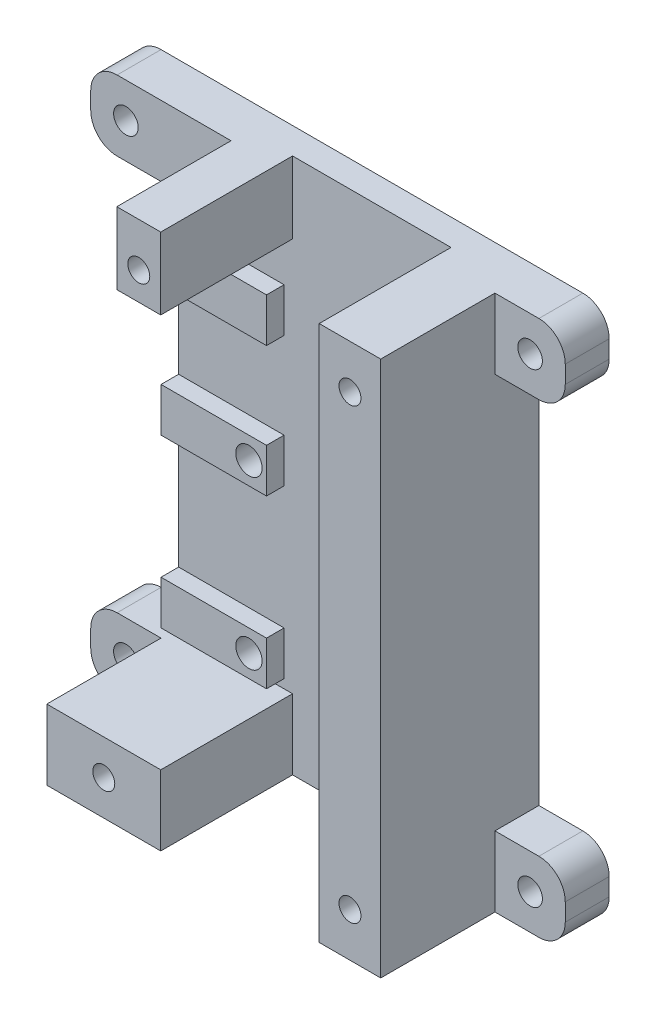
from build123d import *

# Parameters (mm, degrees)
ESQUISSE1_W             = 35
ESQUISSE1_H             = 40
BOSS_EXTRU_1_DEPTH      = 3
ESQUISSE2_R             = 2.013179567
ESQUISSE2_R_2           = 1.5
ENL_V_MAT_EXTRU_1_DEPTH = 10
ESQUISSE3_W             = 35
ESQUISSE3_H             = 3
BOSS_EXTRU_2_DEPTH      = 5
ESQUISSE4_W             = 4
ESQUISSE4_H             = 45
ESQUISSE4_W_2           = 12.966129595
ESQUISSE4_H_2           = 5
BOSS_EXTRU_3_DEPTH      = 15
BOSS_EXTRU_4_DEPTH      = 10
ESQUISSE6_W             = 5
ESQUISSE6_H             = 5.175
BOSS_EXTRU_5_DEPTH      = 15
ESQUISSE7_W             = 18
ESQUISSE7_H             = 55
BOSS_EXTRU_6_DEPTH      = 3
BOSS_EXTRU_7_DEPTH      = 3
BOSS_EXTRU_8_DEPTH      = 3
ESQUISSE10_R            = 1.25
ENL_V_MAT_EXTRU_2_DEPTH = 6
ESQUISSE11_W            = 5
ESQUISSE11_H            = 8
BOSS_EXTRU_9_DEPTH      = 8
ESQUISSE12_R            = 1.4
ENL_V_MAT_EXTRU_3_DEPTH = 8
ESQUISSE13_W            = 7.966129595
ESQUISSE13_H            = 8.175
BOSS_EXTRU_10_DEPTH     = 2
BOSS_EXTRU_12_START     = 2
ESQUISSE14_W            = 12
ESQUISSE14_H            = 5
ESQUISSE14_R            = 1.5
BOSS_EXTRU_12_DEPTH     = 2
CONG_1_R                = 3
ENL_V_START             = -2
ESQUISSE15_R            = 3.5
ESQUISSE15_R_2          = 1.5
ENL_V_MAT_EXTRU_4_DEPTH = 2


with BuildPart() as part:
    # Esquisse1 → Boss.-Extru.1 (new body)
    with BuildSketch(Plane.XY):
        Rectangle(ESQUISSE1_W, ESQUISSE1_H)
    extrude(amount=BOSS_EXTRU_1_DEPTH)

    # Esquisse2 → Enlèv. mat.-Extru.1 (cut)
    with BuildSketch(Plane.XY.offset(3)):
        with Locations((-7.5, 634.376711736)):
            Circle(ESQUISSE2_R)
        with Locations((-7.023580812, 615.376711736)):
            Circle(ESQUISSE2_R)
        with Locations((-7.5, 2.5)):
            Circle(ESQUISSE2_R_2)
        with Locations((-7.5, -16.5)):
            Circle(ESQUISSE2_R_2)
    extrude(amount=-ENL_V_MAT_EXTRU_1_DEPTH, mode=Mode.SUBTRACT)

    # Esquisse3 → Boss.-Extru.2 (add)
    with BuildSketch(Plane.XZ.offset(20)):
        with Locations((0, 1.5)):
            Rectangle(ESQUISSE3_W, ESQUISSE3_H)
    extrude(amount=BOSS_EXTRU_2_DEPTH)

    # Esquisse4 → Boss.-Extru.3 (add)
    with BuildSketch(Plane.XY.offset(3)):
        with Locations((15.5, -2.5)):
            Rectangle(ESQUISSE4_W, ESQUISSE4_H)
        with Locations((-11.016935203, -22.5)):
            Rectangle(ESQUISSE4_W_2, ESQUISSE4_H_2)
    extrude(amount=BOSS_EXTRU_3_DEPTH)

    # Esquisse5 → Boss.-Extru.4 (add)
    with BuildSketch(Plane(origin=(0, 20, 0), x_dir=(1, 0, 0), z_dir=(0, 1, 0))):
        Polygon((17.5, 0), (-17.5, 0), (-17.5, -3), (13.5, -3), (13.5, -18), (17.5, -18), align=None)
    extrude(amount=BOSS_EXTRU_4_DEPTH)

    # Esquisse6 → Boss.-Extru.5 (add)
    with BuildSketch(Plane.XY.offset(3)):
        with Locations((-7.033870405, 27.4125)):
            Rectangle(ESQUISSE6_W, ESQUISSE6_H)
    extrude(amount=BOSS_EXTRU_5_DEPTH)

    # Esquisse7 → Boss.-Extru.6 (add)
    with BuildSketch(Plane(origin=(17.5, 0, 0), x_dir=(0, 0, -1), z_dir=(1, 0, 0))):
        with Locations((-9, 2.5)):
            Rectangle(ESQUISSE7_W, ESQUISSE7_H)
    extrude(amount=BOSS_EXTRU_6_DEPTH)

    # Esquisse8 → Boss.-Extru.7 (add)
    with BuildSketch(Plane.XZ.offset(25)):
        Polygon((-17.5, 18), (-17.5, 0), (20.5, 0), (20.5, 18), (13.5, 18), (13.5, 3), (-4.533870405, 3), (-4.533870405, 18), align=None)
    extrude(amount=BOSS_EXTRU_7_DEPTH)

    # Esquisse9 → Boss.-Extru.8 (add)
    with BuildSketch(Plane(origin=(0, 30, 0), x_dir=(1, 0, 0), z_dir=(0, 1, 0))):
        Polygon((13.5, -18), (20.5, -18), (20.5, 0), (-17.5, 0), (-17.5, -3), (-9.533870405, -3), (-9.533870405, -18), (-4.533870405, -18), (-4.533870405, -3), (13.5, -3), align=None)
    extrude(amount=BOSS_EXTRU_8_DEPTH)

    # Esquisse10 → Enlèv. mat.-Extru.2 (cut)
    with BuildSketch(Plane.XY.offset(18)):
        with Locations((17, -23)):
            Circle(ESQUISSE10_R)
        with Locations((17, 28)):
            Circle(ESQUISSE10_R)
        with Locations((-11.016935202, -24)):
            Circle(ESQUISSE10_R)
        with Locations((-7.033870405, 28)):
            Circle(ESQUISSE10_R)
    extrude(amount=-ENL_V_MAT_EXTRU_2_DEPTH, mode=Mode.SUBTRACT)

    # Esquisse11 → Boss.-Extru.9 (add)
    with BuildSketch(Plane(origin=(20.5, 0, 0), x_dir=(0, 0, -1), z_dir=(1, 0, 0))):
        with Locations((-2.5, -24)):
            Rectangle(ESQUISSE11_W, ESQUISSE11_H)
        with Locations((-2.5, 29)):
            Rectangle(ESQUISSE11_W, ESQUISSE11_H)
    boss_extru_9 = extrude(amount=BOSS_EXTRU_9_DEPTH)

    # Esquisse12 → Enlèv. mat.-Extru.3 (cut)
    with BuildSketch(Plane.XY.offset(5)):
        with Locations((24.5, -24)):
            Circle(ESQUISSE12_R)
        with Locations(Location((24.5, 29, 0), (0, 0, 180))):
            Circle(ESQUISSE12_R)
    enl_v_mat_extru_3 = extrude(amount=-ENL_V_MAT_EXTRU_3_DEPTH, mode=Mode.SUBTRACT)

    # Symétrie1: Boss.-Extru.9, Enlèv. mat.-Extru.3 across plane
    add(boss_extru_9.mirror(Plane(origin=(1.5, 0, 0), x_dir=(0, 0, 1), z_dir=(1, 0, 0))))
    add(enl_v_mat_extru_3.mirror(Plane(origin=(1.5, 0, 0), x_dir=(0, 0, 1), z_dir=(1, 0, 0))), mode=Mode.SUBTRACT)

    # Esquisse13 → Boss.-Extru.10 (add)
    with BuildSketch(Plane.XY.offset(3)):
        with Locations((-13.516935203, 28.9125)):
            Rectangle(ESQUISSE13_W, ESQUISSE13_H)
    extrude(amount=BOSS_EXTRU_10_DEPTH)

    # Esquisse14 → Boss.-Extru.12 (add)
    # profile 1 of 3: a face of its own
    with BuildSketch(Plane.XY.offset(3).offset(BOSS_EXTRU_12_START)):
        with Locations((-11.5, 17.325)):
            Rectangle(ESQUISSE14_W, ESQUISSE14_H)
    # profile 2 of 3: a face of its own
    with BuildSketch(Plane.XY.offset(3).offset(BOSS_EXTRU_12_START)):
        with Locations((-11.5, 2.5)):
            Rectangle(ESQUISSE14_W, ESQUISSE14_H)
        with Locations((-7.5, 2.5)):
            Circle(ESQUISSE14_R, mode=Mode.SUBTRACT)
    # profile 3 of 3: a face of its own
    with BuildSketch(Plane.XY.offset(3).offset(BOSS_EXTRU_12_START)):
        with Locations((-11.5, -16.5)):
            Rectangle(ESQUISSE14_W, ESQUISSE14_H)
        with Locations((-7.5, -16.5)):
            Circle(ESQUISSE14_R, mode=Mode.SUBTRACT)
    extrude(amount=-BOSS_EXTRU_12_DEPTH)

    # Congé1
    cong_1_edges = [part.edges().sort_by_distance(p)[0] for p in [
        (-25.5, 33, 2.5),
        (-25.5, 25, 2.5),
        (-25.5, -28, 2.5),
        (-25.5, -20, 2.5),
        (28.5, 33, 2.5),
        (28.5, 25, 2.5),
        (28.5, -20, 2.5),
        (28.5, -28, 2.5),
    ]]
    fillet(cong_1_edges, radius=CONG_1_R)

    # Esquisse15 → Enlèv. mat.-Extru.4 (cut)
    # profile 1 of 2: a face of its own
    with BuildSketch(Plane(origin=(0, 0, 0), x_dir=(-1, 0, 0), z_dir=(0, 0, -1)).offset(ENL_V_START)):
        with Locations((7.5, 2.5)):
            Circle(ESQUISSE15_R)
        with Locations(Location((7.5, 2.5, 0), (0, 0, 180))):
            Circle(ESQUISSE15_R_2, mode=Mode.SUBTRACT)
    # profile 2 of 2: a face of its own
    with BuildSketch(Plane(origin=(0, 0, 0), x_dir=(-1, 0, 0), z_dir=(0, 0, -1)).offset(ENL_V_START)):
        with Locations((7.5, -16.5)):
            Circle(ESQUISSE15_R)
        with Locations(Location((7.5, -16.5, 0), (0, 0, 180))):
            Circle(ESQUISSE15_R_2, mode=Mode.SUBTRACT)
    extrude(amount=ENL_V_MAT_EXTRU_4_DEPTH, mode=Mode.SUBTRACT)


solid = part.part
